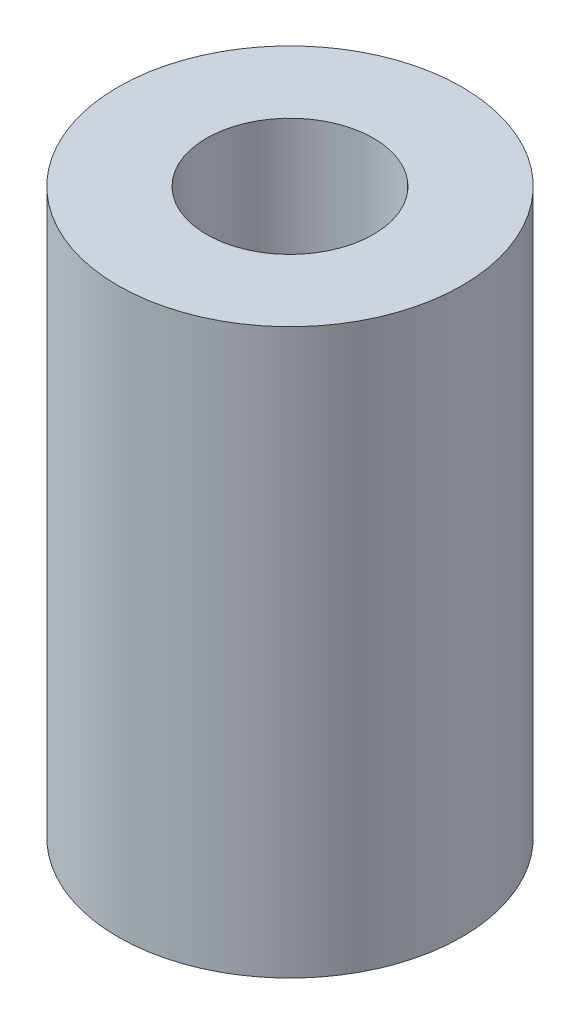
from build123d import *

# Parameters (mm, degrees)
SKETCH1_W = 1.634484305
SKETCH1_H = 10.414


with BuildPart() as part:
    # Sketch1 → Revolve1 (revolve)
    with BuildSketch(Plane.XY, mode=Mode.PRIVATE) as revolve1_sk:
        with Locations((-2.357757848, 4.880103139)):
            Rectangle(SKETCH1_W, SKETCH1_H)
    revolve(revolve1_sk.sketch.rotate(Axis((0, 0, 0), (0, 1, 0)), 270), axis=Axis((0, 0, 0), (0, 1, 0)))


solid = part.part
